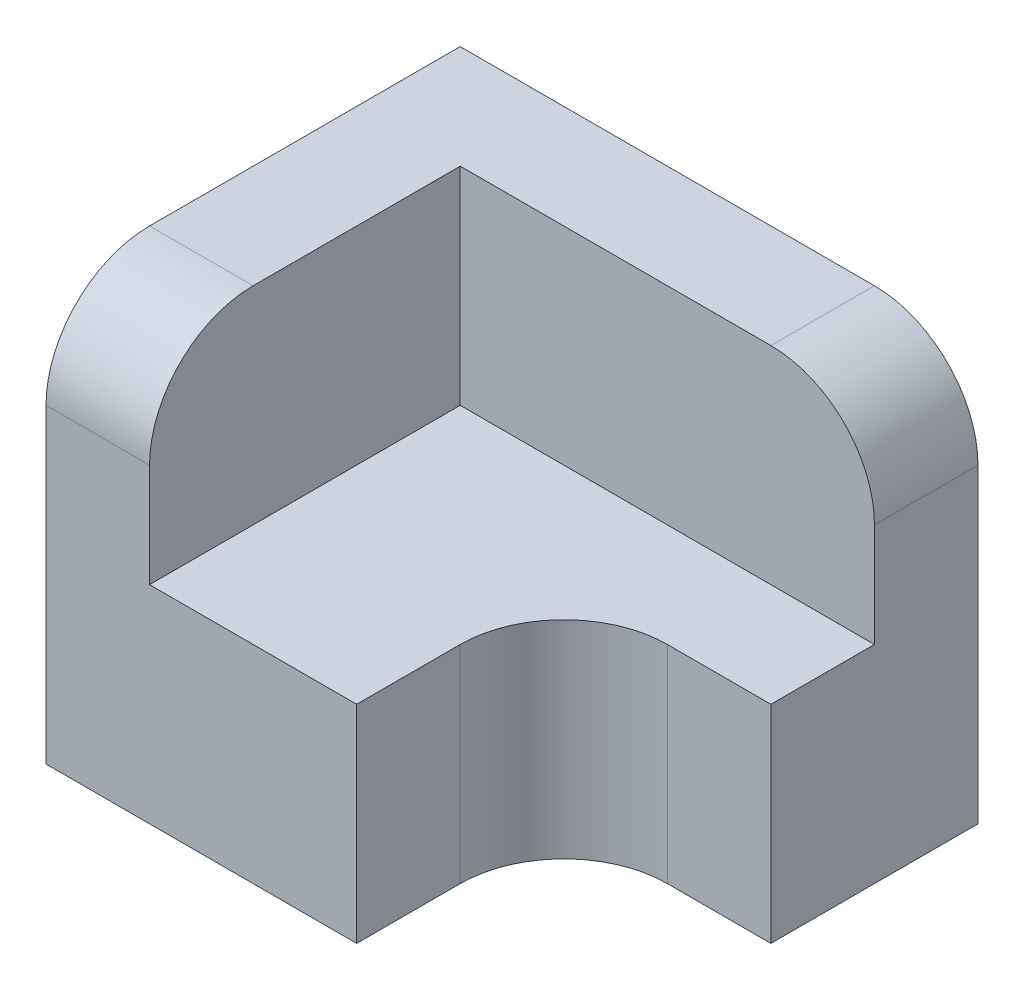
from build123d import *

# Parameters (mm, degrees)
BOSS_EXTRUDE1_DEPTH = 20
BOSS_EXTRUDE2_DEPTH = 10
BOSS_EXTRUDE3_DEPTH = 10


with BuildPart() as part:
    # Sketch1 → Boss-Extrude1 (new body)
    with BuildSketch(Plane(origin=(0, 0, 0), x_dir=(1, 0, 0), z_dir=(0, 1, 0))):
        with BuildLine():
            Line((-45.681063123, 29.900332226), (-45.681063123, -10.099667774))
            Line((-45.681063123, -10.099667774), (-15.681063123, -10.099667774))
            Line((-15.681063123, -10.099667774), (-15.681063123, -0.099667774))
            ThreePointArc((-15.681063123, -0.099667774), (-12.752130935, 6.971400038), (-5.681063123, 9.900332226))
            Line((-5.681063123, 9.900332226), (4.318936877, 9.900332226))
            Line((4.318936877, 9.900332226), (4.318936877, 29.900332226))
            Line((4.318936877, 29.900332226), (-45.681063123, 29.900332226))
        make_face()
    extrude(amount=BOSS_EXTRUDE1_DEPTH)

    # Sketch2 → Boss-Extrude2 (add)
    with BuildSketch(Plane.ZY.offset(45.681063123)):
        with BuildLine():
            Line((-29.900332226, 20), (-29.900332226, 40))
            Line((-29.900332226, 40), (0.099667774, 40))
            ThreePointArc((0.099667774, 40), (7.170735586, 37.071067812), (10.099667774, 30))
            Line((10.099667774, 30), (10.099667774, 20))
            Line((10.099667774, 20), (-29.900332226, 20))
        make_face()
    extrude(amount=-BOSS_EXTRUDE2_DEPTH)

    # Sketch3 → Boss-Extrude3 (add)
    with BuildSketch(Plane(origin=(0, 0, -29.900332226), x_dir=(-1, 0, 0), z_dir=(0, 0, -1))):
        with BuildLine():
            Line((-4.318936877, 20), (35.681063123, 20))
            Line((35.681063123, 20), (35.681063123, 40))
            Line((35.681063123, 40), (5.681063123, 40))
            ThreePointArc((5.681063123, 40), (-1.390004689, 37.071067812), (-4.318936877, 30))
            Line((-4.318936877, 30), (-4.318936877, 20))
        make_face()
    extrude(amount=-BOSS_EXTRUDE3_DEPTH)


solid = part.part
